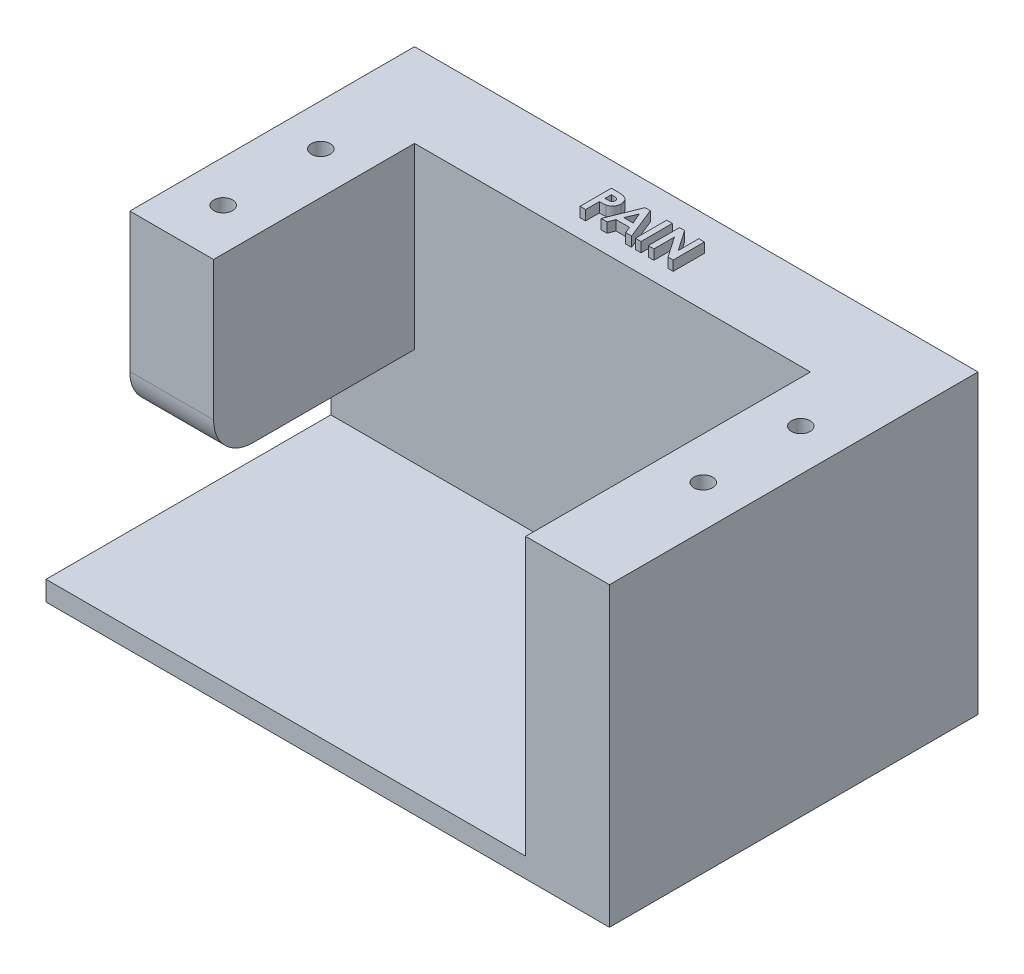
from build123d import *

# Parameters (mm, degrees)
SKETCH1_W           = 57.16
SKETCH1_H           = 37.39
SKETCH1_W_2         = 40.16
SKETCH1_H_2         = 20.39
BOSS_EXTRUDE1_DEPTH = 2
SKETCH2_W           = 57.16
SKETCH2_H           = 37.39
SKETCH2_W_2         = 40.16
SKETCH2_H_2         = 20.39
BOSS_EXTRUDE2_DEPTH = 28.1
SKETCH3_W           = 48.66
SKETCH3_H           = 8.5
CUT_EXTRUDE1_DEPTH  = 28.1
CUT_EXTRUDE2_REACH  = 62.194
SKETCH5_W           = 20.39
SKETCH5_H           = 10
FILLET1_R           = 4
SKETCH6_R           = 0.95
CUT_EXTRUDE3_DEPTH  = 12
SKETCH7_W           = 0.569871794
SKETCH7_H           = 3.175
BOSS_EXTRUDE3_DEPTH = 1


with BuildPart() as part:
    # Sketch1 → Boss-Extrude1 (new body)
    # profile 1 of 2: a face of its own
    with BuildSketch(Plane(origin=(0, 0, 0), x_dir=(1, 0, 0), z_dir=(0, 1, 0))):
        Rectangle(SKETCH1_W, SKETCH1_H)
        Rectangle(SKETCH1_W_2, SKETCH1_H_2, mode=Mode.SUBTRACT)
    # profile 2 of 2: a face of its own
    with BuildSketch(Plane(origin=(0, 0, 0), x_dir=(1, 0, 0), z_dir=(0, 1, 0))):
        Rectangle(SKETCH1_W_2, SKETCH1_H_2)
    extrude(amount=BOSS_EXTRUDE1_DEPTH)

    # Sketch2 → Boss-Extrude2 (add)
    with BuildSketch(Plane(origin=(0, 2, 0), x_dir=(1, 0, 0), z_dir=(0, 1, 0))):
        Rectangle(SKETCH2_W, SKETCH2_H)
        Rectangle(SKETCH2_W_2, SKETCH2_H_2, mode=Mode.SUBTRACT)
    extrude(amount=BOSS_EXTRUDE2_DEPTH)

    # Sketch3 → Cut-Extrude1 (cut)
    with BuildSketch(Plane(origin=(0, 30.1, 0), x_dir=(1, 0, 0), z_dir=(0, 1, 0))):
        with Locations((-4.25, -14.445)):
            Rectangle(SKETCH3_W, SKETCH3_H)
    extrude(amount=-CUT_EXTRUDE1_DEPTH, mode=Mode.SUBTRACT)

    # Sketch5 → Cut-Extrude2 (cut, up to next)
    with BuildSketch(Plane(origin=(-20.08, 0, 0), x_dir=(0, 0, -1), z_dir=(1, 0, 0)), mode=Mode.PRIVATE) as cut_extrude2_sk1:
        with Locations((0, 7)):
            Rectangle(SKETCH5_W, SKETCH5_H)
    cut_extrude2_tool1 = extrude(cut_extrude2_sk1.sketch, amount=-CUT_EXTRUDE2_REACH, mode=Mode.PRIVATE) & part.part
    add(cut_extrude2_tool1.solids().sort_by_distance((-20.08, 7, 0))[0], mode=Mode.SUBTRACT)

    # Fillet1
    fillet1_edges = [part.edges().sort_by_distance(p)[0] for p in [
        (-24.33, 12, 10.195),
    ]]
    fillet(fillet1_edges, radius=FILLET1_R)

    # Sketch6 → Cut-Extrude3 (cut)
    with BuildSketch(Plane(origin=(0, 30.1, 0), x_dir=(1, 0, 0), z_dir=(0, 1, 0))):
        with Locations(Location((-24.35, -4.95, 0), (0, 0, 270))):
            Circle(SKETCH6_R)
        with Locations(Location((-24.35, 4.95, 0), (0, 0, 90))):
            Circle(SKETCH6_R)
        with Locations(Location((24.35, 4.95, 0), (0, 0, 270))):
            Circle(SKETCH6_R)
        with Locations(Location((24.35, -4.95, 0), (0, 0, 90))):
            Circle(SKETCH6_R)
    extrude(amount=-CUT_EXTRUDE3_DEPTH, mode=Mode.SUBTRACT)

    # Sketch7 → Boss-Extrude3 (add)
    # profile 1 of 4: a face of its own
    with BuildSketch(Plane(origin=(0, 30.1, 0), x_dir=(1, 0, 0), z_dir=(0, 1, 0))):
        with BuildLine():
            Line((-5.16235185, 15.241554144), (-4.526334221, 15.241554144))
            add(Edge.make_bspline(
                [(-4.526334221, 15.241554144), (-4.484777655, 15.241368128), (-4.404606327, 15.241009264), (-4.288992676, 15.236657561), (-4.182333422, 15.228859045), (-4.08465307, 15.219221313), (-3.995991784, 15.205709587), (-3.916238533, 15.190219451), (-3.845376767, 15.171347958), (-3.782607413, 15.148947756), (-3.726273946, 15.122538794), (-3.672964317, 15.094411364), (-3.623883329, 15.060842269), (-3.576553717, 15.025449442), (-3.533681396, 14.984851821), (-3.492591735, 14.941751237), (-3.455024992, 14.894438355), (-3.420807097, 14.843485885), (-3.389766194, 14.789835212), (-3.362646785, 14.733390423), (-3.340649039, 14.6740622), (-3.322195665, 14.612234331), (-3.307373735, 14.547909509), (-3.297507787, 14.48069213), (-3.290806339, 14.411051534), (-3.290215029, 14.363654099), (-3.289915952, 14.339681147)],
                knots=[0, 0, 0, 0, 1.698747864, 3.27724071, 4.728299578, 6.070144658, 7.288476769, 8.393259625, 9.389771311, 10.283485332, 11.113357557, 11.931608583, 12.74405601, 13.541433047, 14.344816069, 15.154114104, 15.974336324, 16.810834471, 17.661136416, 18.50621059, 19.367396281, 20.244825668, 21.142564693, 22.063065223, 23.020325768, 24, 24, 24, 24], degree=3))
            add(Edge.make_bspline(
                [(-3.289915952, 14.339681147), (-3.290348678, 14.313160441), (-3.291199038, 14.261043994), (-3.299535306, 14.184647677), (-3.313776285, 14.111810705), (-3.332388499, 14.041918832), (-3.358341909, 13.976121933), (-3.38799246, 13.912850075), (-3.424472043, 13.853877205), (-3.466155799, 13.798465646), (-3.511679216, 13.746164873), (-3.562123017, 13.698484974), (-3.616525724, 13.655100917), (-3.674572416, 13.615558031), (-3.73648102, 13.579936086), (-3.802206865, 13.547901518), (-3.872198765, 13.520478893), (-3.920939018, 13.506137082), (-3.945650127, 13.498865843)],
                knots=[0, 0, 0, 0, 1.102006807, 2.165578795, 3.188629044, 4.184801286, 5.166646146, 6.124351954, 7.085497154, 8.042432466, 9.003981491, 9.963833307, 10.922997304, 11.89326795, 12.880200226, 13.889073926, 14.929769137, 16, 16, 16, 16], degree=3))
            add(Edge.make_bspline(
                [(-3.945650127, 13.498865843), (-3.961926284, 13.494816308), (-3.997185683, 13.486043713), (-4.055530303, 13.477137327), (-4.122766351, 13.468948452), (-4.199111247, 13.461911106), (-4.284609004, 13.45712735), (-4.379176838, 13.45339145), (-4.482857606, 13.450675064), (-4.554953112, 13.450578675), (-4.592480055, 13.450528503)],
                knots=[0, 0, 0, 0, 0.618981996, 1.340914327, 2.176866532, 3.120127938, 4.170906482, 5.338178032, 6.614476169, 8, 8, 8, 8], degree=3))
            Line((-4.592480055, 13.450528503), (-4.592480055, 12.066554144))
            Line((-4.592480055, 12.066554144), (-5.16235185, 12.066554144))
            Line((-5.16235185, 12.066554144), (-5.16235185, 15.241554144))
        make_face()
        with BuildLine():
            Line((-4.592480055, 14.020400298), (-4.390862467, 14.020400298))
            add(Edge.make_bspline(
                [(-4.390862467, 14.020400298), (-4.354174963, 14.020632925), (-4.286669412, 14.021060962), (-4.194480668, 14.027250635), (-4.12039602, 14.036703515), (-4.061867772, 14.050261131), (-4.015654177, 14.070836608), (-3.975797844, 14.094638561), (-3.94161205, 14.124735477), (-3.912012184, 14.159126353), (-3.888347983, 14.198643193), (-3.871938093, 14.242642543), (-3.86127855, 14.290199928), (-3.860294043, 14.323296721), (-3.859787747, 14.340317165)],
                knots=[0, 0, 0, 0, 1.8619151, 3.425951444, 4.686033666, 5.651700536, 6.461346321, 7.243864085, 7.999046032, 8.762387399, 9.539336099, 10.322741239, 11.137448474, 12, 12, 12, 12], degree=3))
            add(Edge.make_bspline(
                [(-3.859787747, 14.340317165), (-3.860288835, 14.355187705), (-3.861261065, 14.384040128), (-3.868403335, 14.425681332), (-3.879786058, 14.464499524), (-3.896279186, 14.5000893), (-3.917600896, 14.532390187), (-3.943596375, 14.56138946), (-3.973932049, 14.587708164), (-3.997352964, 14.601639056), (-4.00925189, 14.608716604)],
                knots=[0, 0, 0, 0, 1.102301479, 2.1387299, 3.123554645, 4.094223062, 5.036071848, 5.982632524, 6.975082478, 8, 8, 8, 8], degree=3))
            add(Edge.make_bspline(
                [(-4.00925189, 14.608716604), (-4.019330967, 14.613813882), (-4.040670438, 14.624605865), (-4.077013627, 14.637152333), (-4.118953111, 14.647736662), (-4.166772031, 14.656521552), (-4.220279622, 14.66333954), (-4.279466337, 14.668553594), (-4.344419277, 14.670650369), (-4.38959016, 14.671328868), (-4.413123084, 14.671682349)],
                knots=[0, 0, 0, 0, 0.656809284, 1.390599849, 2.23162475, 3.173112763, 4.218524733, 5.370385145, 6.63003504, 8, 8, 8, 8], degree=3))
            Line((-4.413123084, 14.671682349), (-4.592480055, 14.671682349))
            Line((-4.592480055, 14.671682349), (-4.592480055, 14.020400298))
        make_face(mode=Mode.SUBTRACT)
    # profile 2 of 4: a face of its own
    with BuildSketch(Plane(origin=(0, 30.1, 0), x_dir=(1, 0, 0), z_dir=(0, 1, 0))):
        Polygon((-1.743757098, 15.241554144), (-1.213954414, 15.241554144), (0.068257125, 12.066554144), (-0.540411746, 12.066554144), (-0.787186585, 12.717836195), (-2.169252891, 12.717836195), (-2.416663749, 12.066554144), (-3.025332619, 12.066554144), align=None)
        Polygon((-1.478537747, 14.38992654), (-1.953006898, 13.28770799), (-1.003432579, 13.28770799), align=None, mode=Mode.SUBTRACT)
    # profile 3 of 4: a face of its own
    with BuildSketch(Plane(origin=(0, 30.1, 0), x_dir=(1, 0, 0), z_dir=(0, 1, 0))):
        with Locations((0.73989174, 13.654054144)):
            Rectangle(SKETCH7_W, SKETCH7_H)
    # profile 4 of 4: a face of its own
    with BuildSketch(Plane(origin=(0, 30.1, 0), x_dir=(1, 0, 0), z_dir=(0, 1, 0))):
        Polygon((1.757519945, 15.241554144), (2.270786171, 15.241554144), (3.711366099, 13.152236235), (3.711366099, 15.241554144), (4.281237894, 15.241554144), (4.281237894, 12.066554144), (3.764155562, 12.066554144), (2.32739174, 14.149511876), (2.32739174, 12.066554144), (1.757519945, 12.066554144), align=None)
    extrude(amount=BOSS_EXTRUDE3_DEPTH)


solid = part.part
